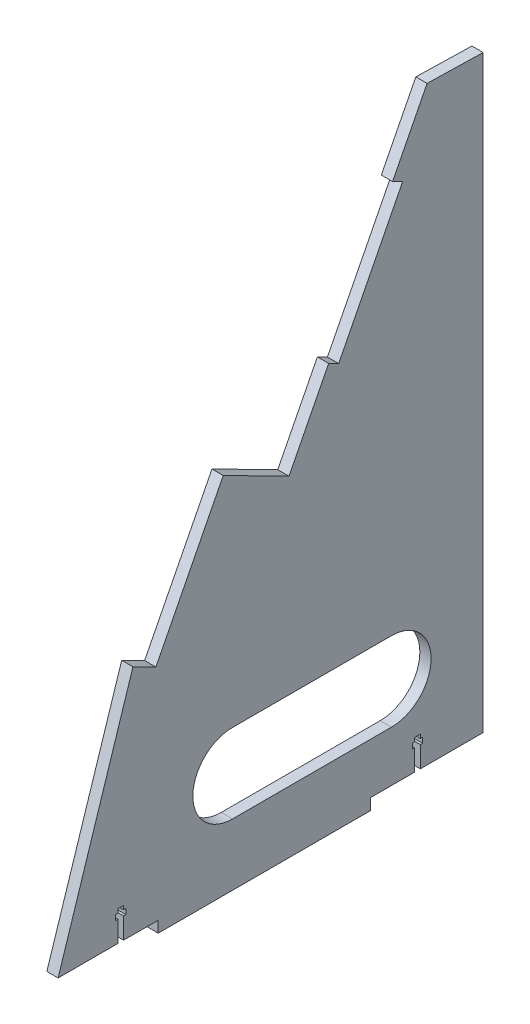
from build123d import *

# Parameters (mm, degrees)
BOSS_EXTRUDE1_DEPTH = 6
CUT_EXTRUDE1_DEPTH  = 6
SKETCH3_W           = 6
SKETCH3_H           = 113
BOSS_EXTRUDE2_DEPTH = 6
SKETCH4_W           = 3.1
SKETCH4_H           = 16
CUT_EXTRUDE2_DEPTH  = 6
SKETCH5_W           = 5.5
SKETCH5_H           = 2.8
CUT_EXTRUDE3_DEPTH  = 6


with BuildPart() as part:
    # Sketch1 → Boss-Extrude1 (new body)
    with BuildSketch(Plane(origin=(0, 0, 0), x_dir=(0, 0, -1), z_dir=(1, 0, 0))):
        Polygon((42.307983077, 123.832979907), (2.448355916, 0.258483339), (228.768209888, 0.258483339), (228.768209888, 313.843147788), (198.909979532, 314.531209333), (180.529620903, 278.442257884), (185.876132229, 275.719241791), (151.838431063, 208.887850219), (146.491919737, 211.610866313), (125.388545015, 170.175403538), (90.368895831, 188.011158949), (54.515850604, 117.615426494), align=None)
    extrude(amount=BOSS_EXTRUDE1_DEPTH)

    # Sketch2 → Cut-Extrude1 (cut)
    with BuildSketch(Plane(origin=(6, 0, 0), x_dir=(0, 0, -1), z_dir=(1, 0, 0))):
        with BuildLine():
            Line((95.286629817, 69.348811068), (179.963244622, 69.348811068))
            ThreePointArc((179.963244622, 69.348811068), (201.051431087, 48.260624604), (179.963244622, 27.172438139))
            Line((179.963244622, 27.172438139), (95.286629817, 27.172438139))
            ThreePointArc((95.286629817, 27.172438139), (74.198443353, 48.260624604), (95.286629817, 69.348811068))
        make_face()
    extrude(amount=-CUT_EXTRUDE1_DEPTH, mode=Mode.SUBTRACT)

    # Sketch3 → Boss-Extrude2 (add)
    with BuildSketch(Plane.XZ.offset(-0.258483339)):
        with Locations((3, -112.268209888)):
            Rectangle(SKETCH3_W, SKETCH3_H)
    extrude(amount=BOSS_EXTRUDE2_DEPTH)

    # Sketch4 → Cut-Extrude2 (cut)
    with BuildSketch(Plane(origin=(6, 0, 0), x_dir=(0, 0, -1), z_dir=(1, 0, 0))):
        with Locations((35.768209888, 8.258483339)):
            Rectangle(SKETCH4_W, SKETCH4_H)
        with Locations((193.768209888, 8.258483339)):
            Rectangle(SKETCH4_W, SKETCH4_H)
    extrude(amount=-CUT_EXTRUDE2_DEPTH, mode=Mode.SUBTRACT)

    # Sketch5 → Cut-Extrude3 (cut)
    with BuildSketch(Plane(origin=(6, 0, 0), x_dir=(0, 0, -1), z_dir=(1, 0, 0))):
        with Locations((35.768209888, 12.858483339)):
            Rectangle(SKETCH5_W, SKETCH5_H)
        with Locations((193.768209888, 12.858483339)):
            Rectangle(SKETCH5_W, SKETCH5_H)
    extrude(amount=-CUT_EXTRUDE3_DEPTH, mode=Mode.SUBTRACT)


solid = part.part
